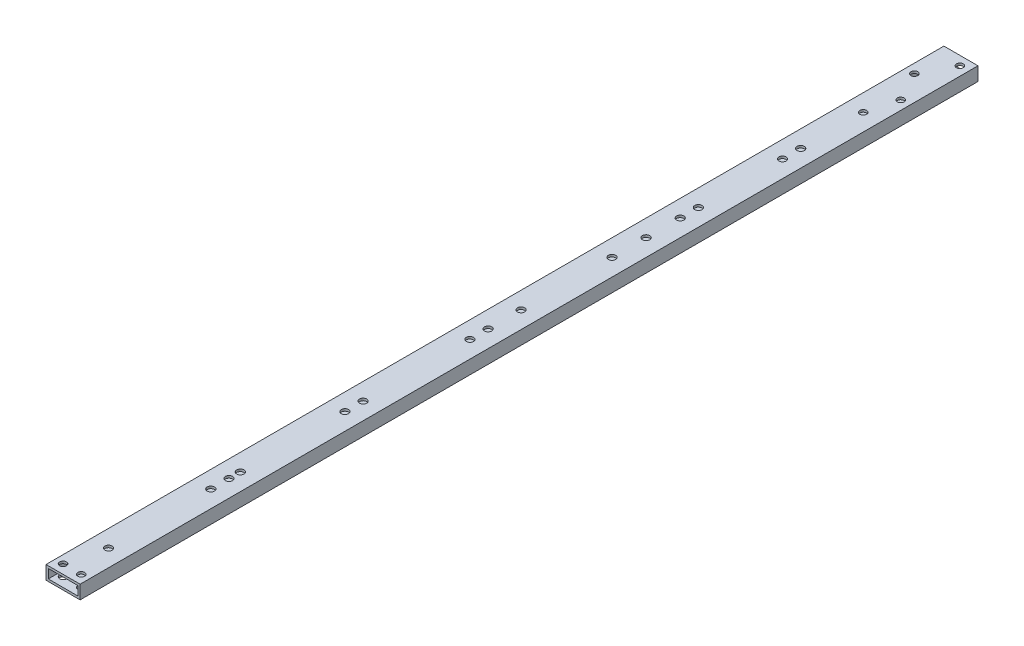
from build123d import *

# Parameters (mm, degrees)
SKETCH_1_W          = 15
SKETCH_1_H          = 6
SKETCH_1_W_2        = 13
SKETCH_1_H_2        = 4
EXTRUDE_1_DEPTH     = 400
SKETCH_2_R          = 1.5
CUT_EXTRUDE_1_DEPTH = 10
SKETCH_3_R          = 1.6
SKETCH_3_R_2        = 1.5
CUT_EXTRUDE_2_DEPTH = 401.115295884
SKETCH_4_W          = 23.248970848
SKETCH_4_H          = 9.936482471
CUT_EXTRUDE_3_DEPTH = 10


with BuildPart() as part:
    # 草图1 → 凸台-拉伸1 (new body)
    with BuildSketch(Plane.XY):
        Rectangle(SKETCH_1_W, SKETCH_1_H)
        Rectangle(SKETCH_1_W_2, SKETCH_1_H_2, mode=Mode.SUBTRACT)
    extrude(amount=EXTRUDE_1_DEPTH)

    # 草图2 → 切除-拉伸1 (cut)
    with BuildSketch(Plane.XZ.offset(3)):
        with Locations(Location((3.5, 35, 0), (0, 0, 270))):
            Circle(SKETCH_2_R)
        with Locations(Location((3.5, 9, 0), (0, 0, 270))):
            Circle(SKETCH_2_R)
        with Locations(Location((-3.5, 22, 0), (0, 0, 270))):
            Circle(SKETCH_2_R)
        with Locations(Location((0, 48, 0), (0, 0, 270))):
            Circle(SKETCH_2_R)
    extrude(amount=-CUT_EXTRUDE_1_DEPTH, mode=Mode.SUBTRACT)

    # 草图3 → 切除-拉伸2 (cut, through all)
    with BuildSketch(Plane(origin=(0, 3, 0), x_dir=(1, 0, 0), z_dir=(0, 1, 0))):
        with Locations(Location((0, -335, 0), (0, 0, 270))):
            Circle(SKETCH_3_R)
        with Locations(Location((0, -327, 0), (0, 0, 270))):
            Circle(SKETCH_3_R)
        with Locations(Location((0, -198.5, 0), (0, 0, 270))):
            Circle(SKETCH_3_R)
        with Locations(Location((0, -276, 0), (0, 0, 270))):
            Circle(SKETCH_3_R)
        with Locations(Location((0, -268, 0), (0, 0, 270))):
            Circle(SKETCH_3_R)
        with Locations(Location((4, -396, 0), (0, 0, 270))):
            Circle(SKETCH_3_R_2)
        with Locations(Location((-4, -396, 0), (0, 0, 90))):
            Circle(SKETCH_3_R_2)
        with Locations(Location((0, -221, 0), (0, 0, 270))):
            Circle(SKETCH_3_R)
        with Locations(Location((0, -213, 0), (0, 0, 270))):
            Circle(SKETCH_3_R)
        with Locations(Location((0, -158.5, 0), (0, 0, 270))):
            Circle(SKETCH_3_R)
        with Locations(Location((0, -143.5, 0), (0, 0, 270))):
            Circle(SKETCH_3_R)
        with Locations(Location((0, -120.5, 0), (0, 0, 270))):
            Circle(SKETCH_3_R)
        with Locations(Location((0, -128.5, 0), (0, 0, 270))):
            Circle(SKETCH_3_R)
        with Locations(Location((0, -75.5, 0), (0, 0, 270))):
            Circle(SKETCH_3_R)
        with Locations(Location((0, -83.5, 0), (0, 0, 270))):
            Circle(SKETCH_3_R)
        with Locations(Location((0, -380, 0), (0, 0, 270))):
            Circle(SKETCH_3_R)
        with Locations(Location((0, -322, 0), (0, 0, 270))):
            Circle(SKETCH_3_R)
    extrude(amount=-CUT_EXTRUDE_2_DEPTH, mode=Mode.SUBTRACT)

    # 草图4 → 切除-拉伸3 (cut)
    with BuildSketch(Plane(origin=(0, 3, 0), x_dir=(1, 0, 0), z_dir=(0, 1, 0))):
        with Locations((0, -0.031758764)):
            Rectangle(SKETCH_4_W, SKETCH_4_H)
    extrude(amount=-CUT_EXTRUDE_3_DEPTH, mode=Mode.SUBTRACT)


solid = part.part
